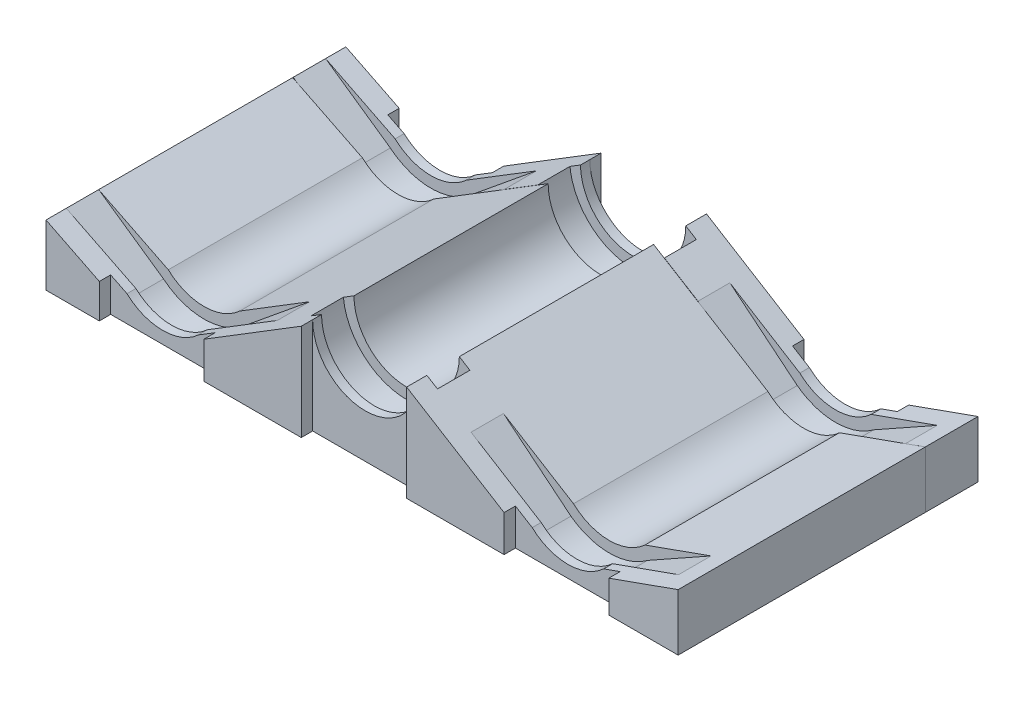
from build123d import *

# Parameters (mm, degrees)
SKETCH_1_W          = 78
SKETCH_1_H          = 4
EXTRUDE_1_DEPTH     = 15
EXTRUDE_1_2_DEPTH   = 15
CUT_EXTRUDE_1_DEPTH = 32
SKETCH_3_W          = 78
SKETCH_3_H          = 2.5
EXTRUDE_2_DEPTH     = 15
CUT_EXTRUDE_5_DEPTH = 37
SKETCH_5_W          = 13
SKETCH_5_H          = 11.9
CUT_EXTRUDE_6_DEPTH = 1.4
SKETCH_6_W          = 13
SKETCH_6_H          = 11.9
CUT_EXTRUDE_7_DEPTH = 1.4


with BuildPart() as part:
    # Эскиз1 → Бобышка-Вытянуть1 (new body)
    with BuildSketch(Plane(origin=(0, 72.101425994, 0), x_dir=(1, 0, 0), z_dir=(0, 1, 0))):
        with Locations((69.741769048, -100.552702475)):
            Rectangle(SKETCH_1_W, SKETCH_1_H)
    extrude(amount=EXTRUDE_1_DEPTH)


with BuildPart() as body_2:
    # Эскиз1 → Extrude 1 2 (new body)
    with BuildSketch(Plane(origin=(0, 72.101425994, 0), x_dir=(1, 0, 0), z_dir=(0, 1, 0))):
        with Locations((69.741769048, -72.552702475)):
            Rectangle(SKETCH_1_W, SKETCH_1_H)
    extrude(amount=EXTRUDE_1_2_DEPTH)


with BuildPart() as cut_extrude_1_tool:
    # Эскиз2 → Вырез-Вытянуть1 (new body)
    with BuildSketch(Plane.XY.offset(102.552702475)):
        with BuildLine():
            Line((30.741769048, 87.101425994), (30.741769048, 79.601425994))
            Line((30.741769048, 79.601425994), (38.7406223, 74.053793994))
            ThreePointArc((38.7406223, 74.053793994), (43.566960712, 72.257224124), (48.468541666, 73.837005729))
            Line((48.468541666, 73.837005729), (60.894137048, 84.001425994))
            ThreePointArc((60.894137048, 84.001425994), (68.741770048, 76.153792994), (76.589403048, 84.001425994))
            Line((76.589403048, 84.001425994), (89.014998431, 73.837005729))
            ThreePointArc((89.014998431, 73.837005729), (93.741770048, 72.25892129), (98.468541666, 73.837005729))
            Line((98.468541666, 73.837005729), (108.741769048, 79.601425994))
            Line((108.741769048, 79.601425994), (108.741769048, 87.101425994))
            Line((108.741769048, 87.101425994), (30.741769048, 87.101425994))
        make_face()
    extrude(amount=-CUT_EXTRUDE_1_DEPTH)


with BuildPart() as part_1:
    add(part.part)

    # Вырез-Вытянуть1: cut by cut_extrude_1_tool
    add(cut_extrude_1_tool.part, mode=Mode.SUBTRACT)



with BuildPart() as body_2_1:
    add(body_2.part)

    # Вырез-Вытянуть1: cut by cut_extrude_1_tool
    add(cut_extrude_1_tool.part, mode=Mode.SUBTRACT)


with BuildPart() as part_2:
    add(part_1.part)

    add(body_2_1.part)  # Бобышка-Вытянуть2 merges body 2
    # Эскиз3 → Бобышка-Вытянуть2 (add)
    with BuildSketch(Plane(origin=(0, 72.101425994, 0), x_dir=(1, 0, 0), z_dir=(0, 1, 0))):
        Polygon((30.741769048, -70.552702475), (30.741769048, -68.052702475), (108.741769048, -68.052702475), (108.741769048, -70.654560826), align=None)
        Polygon((30.741769048, -74.618981064), (30.741769048, -98.552702475), (108.741769048, -98.552702475), (108.741769048, -74.552702475), align=None)
        with Locations((69.741769048, -103.802702475)):
            Rectangle(SKETCH_3_W, SKETCH_3_H)
    extrude(amount=EXTRUDE_2_DEPTH)

    # Эскиз4 → Вырез-Вытянуть5 (cut)
    with BuildSketch(Plane.XY.offset(105.052702475)):
        with BuildLine():
            Line((30.741769048, 79.601425994), (39.329622083, 75.327825775))
            ThreePointArc((39.329622083, 75.327825775), (43.741770048, 73.601094828), (48.153918014, 75.327825775))
            Line((48.153918014, 75.327825775), (62.241769048, 84.001425994))
            ThreePointArc((62.241769048, 84.001425994), (68.741769048, 77.501425994), (75.241769048, 84.001425994))
            Line((75.241769048, 84.001425994), (89.330109389, 75.327825775))
            ThreePointArc((89.330109389, 75.327825775), (93.741769048, 73.601425994), (98.153428707, 75.327825775))
            Line((98.153428707, 75.327825775), (108.741769048, 79.101425994))
            Line((108.741769048, 79.101425994), (108.741769048, 87.101425994))
            Line((108.741769048, 87.101425994), (30.741769048, 87.101425994))
            Line((30.741769048, 87.101425994), (30.741769048, 79.601425994))
        make_face()
    extrude(amount=-CUT_EXTRUDE_5_DEPTH, mode=Mode.SUBTRACT)

    # Эскиз5 → Вырез-Вытянуть6 (cut)
    with BuildSketch(Plane.XY.offset(105.052702475)):
        with Locations((68.741769048, 78.051425994)):
            Rectangle(SKETCH_5_W, SKETCH_5_H)
        Polygon((100.187361471, 80.940674659), (87.265224484, 80.359547889), (87.265224484, 72.101425994), (100.187361471, 72.101425994), align=None)
        Polygon((50.218313612, 80.653123839), (37.321764311, 81.118057283), (37.321764311, 72.101425994), (50.218313612, 72.101425994), align=None)
    extrude(amount=-CUT_EXTRUDE_6_DEPTH, mode=Mode.SUBTRACT)

    # Эскиз6 → Вырез-Вытянуть7 (cut)
    with BuildSketch(Plane(origin=(0, 0, 68.052702475), x_dir=(-1, 0, 0), z_dir=(0, 0, -1))):
        Polygon((-100.187361471, 80.940674659), (-100.187361471, 72.101425994), (-87.265224484, 72.101425994), (-87.265224484, 80.653123839), align=None)
        with Locations((-68.741769048, 78.051425994)):
            Rectangle(SKETCH_6_W, SKETCH_6_H)
        Polygon((-50.218313612, 80.653123839), (-50.218313612, 72.101425994), (-37.321764311, 72.101425994), (-37.321764311, 81.118057283), align=None)
    extrude(amount=-CUT_EXTRUDE_7_DEPTH, mode=Mode.SUBTRACT)


solid = part_2.part
